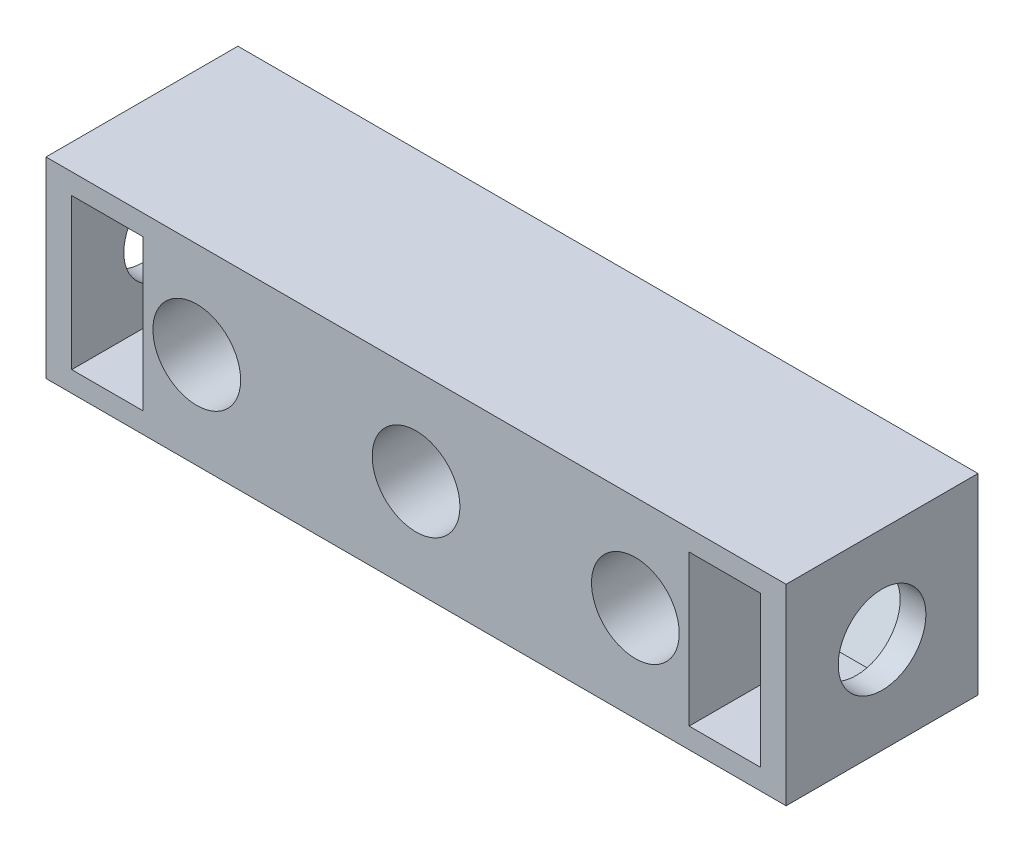
from build123d import *

# Parameters (mm, degrees)
SKETCH1_W                      = 27
SKETCH1_H                      = 7
BOSS_EXTRUDE1_DEPTH            = 7
SIDE_SHAFT_HOLES_M3_AT_2_COUNT = 2
SIDE_SHAFT_HOLES_M3_AT_2_PITCH = 48.812875198
SKETCH9_R                      = 1.6
BOSS_EXTRUDE2_DEPTH            = 3.4
M3_CLEARANCE_HOLE1_D           = 3.2
CUT_EXTRUDE1_START             = -2.1
CUT_EXTRUDE1_DEPTH             = 2.6


with BuildPart() as part:
    # Sketch1 → Boss-Extrude1 (new body)
    with BuildSketch(Plane.XY):
        with Locations((-15, 36.25)):
            Rectangle(SKETCH1_W, SKETCH1_H)
    extrude(amount=BOSS_EXTRUDE1_DEPTH)

    # Sketch2 → Side Shaft Holes (M3) (revolve, cut)
    with BuildSketch(Plane(origin=(-1.5, 36.25, 3.5), x_dir=(0, 0, -1), z_dir=(0, 1, 0))):
        Polygon((0, 0), (0, 4), (1.6, 3.03862301), (1.6, 0), align=None)
    side_shaft_holes_m3 = revolve(axis=Axis((4.85, 36.25, 3.5), (-1, 0, 0)), mode=Mode.SUBTRACT)

    # Side Shaft Holes (M3) at 2: Side Shaft Holes (M3) ×2
    with Locations(*[(0, 0, -i * SIDE_SHAFT_HOLES_M3_AT_2_PITCH) for i in range(1, SIDE_SHAFT_HOLES_M3_AT_2_COUNT)]):
        add(side_shaft_holes_m3, mode=Mode.SUBTRACT)

    # Sketch9 → Boss-Extrude2 (add)
    with BuildSketch(Plane.ZY.offset(4.53862301)):
        with Locations(Location((3.5, 36.25, 0), (0, 0, 180))):
            Circle(SKETCH9_R)
    boss_extrude2 = extrude(amount=BOSS_EXTRUDE2_DEPTH)

    # Shaft Hole Mirror: Side Shaft Holes (M3), Boss-Extrude2 across plane
    add(side_shaft_holes_m3.mirror(Plane.ZY.offset(15)), mode=Mode.SUBTRACT)
    add(boss_extrude2.mirror(Plane.ZY.offset(15)))

    # Shaft Hole Mirror copy 1 sketch → Shaft Hole Mirror copy 1 (revolve, cut)
    with BuildSketch(Plane(origin=(-28.5, 36.25, -45.312875198), x_dir=(0, 0, -1), z_dir=(0, 1, 0))):
        Polygon((0, 0), (0, -4), (1.6, -3.03862301), (1.6, 0), align=None)
    revolve(axis=Axis((-34.85, 36.25, -45.312875198), (-1, 0, 0)), mode=Mode.SUBTRACT)

    # M3 Clearance Hole1 (through all)
    with Locations(Plane.XY.offset(7)):
        with Locations((-7, 36.25), (-15, 36.25), (-23, 36.25)):
            Hole(M3_CLEARANCE_HOLE1_D / 2)

    # Sketch8 → Cut-Extrude1 (cut)
    with BuildSketch(Plane.ZY.offset(4.53862301).offset(CUT_EXTRUDE1_START)):
        Polygon((0.324573519, 36.25), (1.91228676, 33.5), (5.08771324, 33.5), (7, 33.5), (7, 39), (5.08771324, 39), (1.91228676, 39), align=None)
    cut_extrude1 = extrude(amount=CUT_EXTRUDE1_DEPTH, mode=Mode.SUBTRACT)

    # Mirror1: Cut-Extrude1 across plane
    add(cut_extrude1.mirror(Plane.ZY.offset(15)), mode=Mode.SUBTRACT)


solid = part.part
